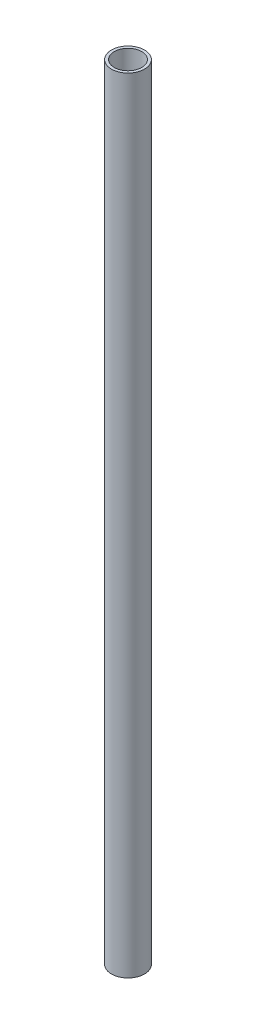
from build123d import *

# Parameters (mm, degrees)
SKETCH1_R           = 21.082
SKETCH1_R_2         = 17.526
BOSS_EXTRUDE1_DEPTH = 996.95


with BuildPart() as part:
    # Sketch1 → Boss-Extrude1 (new body)
    with BuildSketch(Plane(origin=(0, 0, 0), x_dir=(1, 0, 0), z_dir=(0, 1, 0))):
        with Locations(Location((0, 0, 0), (0, 0, 270))):
            Circle(SKETCH1_R)
        with Locations(Location((0, 0, 0), (0, 0, 270))):
            Circle(SKETCH1_R_2, mode=Mode.SUBTRACT)
    extrude(amount=BOSS_EXTRUDE1_DEPTH)


solid = part.part
